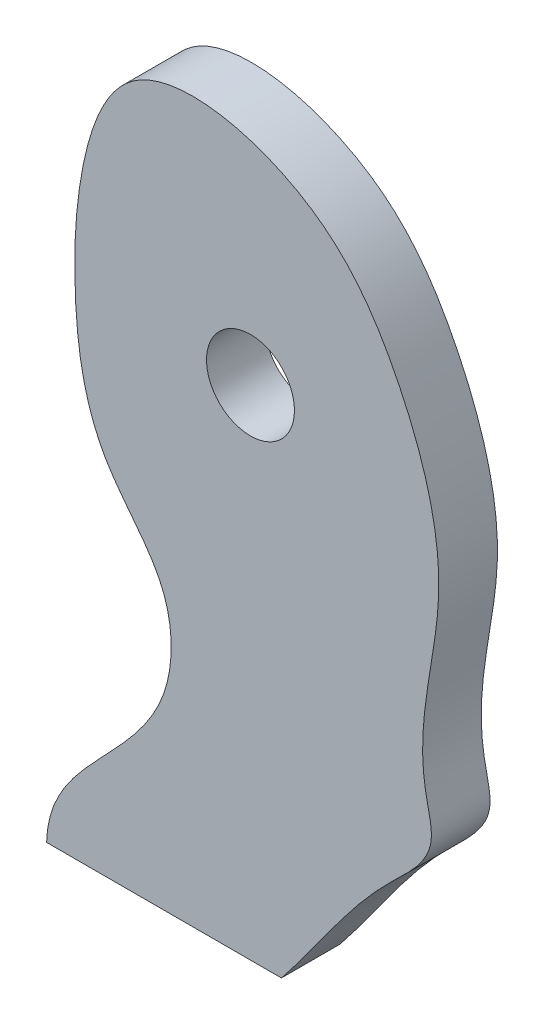
from build123d import *

# Parameters (mm, degrees)
SKETCH1_R           = 2.38125
BOSS_EXTRUDE1_DEPTH = 3.175


with BuildPart() as part:
    # Sketch1 → Boss-Extrude1 (new body)
    with BuildSketch(Plane.XY):
        with BuildLine():
            Line((118.967121116, 34.167212387), (131.678974086, 34.167212387))
            add(Edge.make_bspline(
                [(118.967121116, 34.167212387), (119.030334903, 36.646981492), (121.906398461, 39.544695237), (125.793601399, 43.798563993), (125.891543855, 49.657029521), (121.127487031, 53.881268974), (120.367535927, 60.334121971), (120.600714524, 66.483885791), (123.016973291, 74.722819228), (133.648452355, 72.22183711), (138.493639111, 65.133838074), (141.338222111, 56.381400819), (138.587636306, 49.427867998), (140.262700775, 43.994734022), (135.714079048, 40.185632466), (133.729735142, 36.714193959), (131.678974086, 34.167212387)],
                knots=[0, 0, 0, 0, 0.071904804, 0.130594979, 0.180105574, 0.241274715, 0.322804431, 0.375401332, 0.447915126, 0.555290328, 0.628867273, 0.728217533, 0.835004143, 0.857708121, 0.898521267, 1, 1, 1, 1], degree=3))
        make_face()
        with Locations((130.002685782, 61.127515939)):
            Circle(SKETCH1_R, mode=Mode.SUBTRACT)
    extrude(amount=BOSS_EXTRUDE1_DEPTH)


solid = part.part
